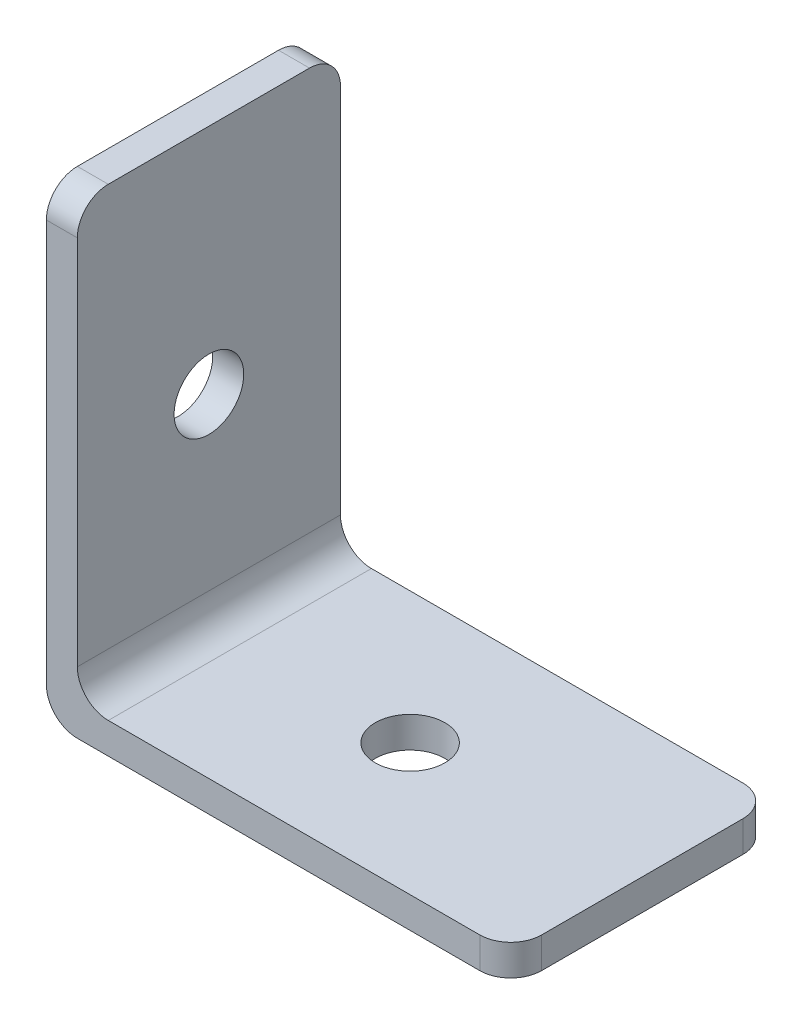
from build123d import *

# Parameters (mm, degrees)
EXTRUDE_THIN1_DEPTH = 17
FILLET1_R           = 2
FILLET2_R           = 2
SKETCH2_R           = 2.25
CUT_EXTRUDE1_DEPTH  = 10
SKETCH4_R           = 2.25
CUT_EXTRUDE2_DEPTH  = 10


with BuildPart() as part:
    # Sketch1 → Extrude-Thin1 (new body)
    with BuildSketch(Plane.XY):
        Polygon((0, 30), (0, 0), (30, 0), (30, 2), (2, 2), (2, 30), align=None)
    extrude(amount=EXTRUDE_THIN1_DEPTH)

    # Fillet1
    fillet1_edges = [part.edges().sort_by_distance(p)[0] for p in [
        (1, 30, 17),
        (1, 30, 0),
        (30, 1, 0),
        (30, 1, 17),
    ]]
    fillet(fillet1_edges, radius=FILLET1_R)

    # Fillet2
    fillet2_edges = [part.edges().sort_by_distance(p)[0] for p in [
        (0, 0, 8.5),
        (2, 2, 8.5),
    ]]
    fillet(fillet2_edges, radius=FILLET2_R)

    # Sketch2 → Cut-Extrude1 (cut)
    with BuildSketch(Plane.ZY):
        with Locations((8.5, 15)):
            Circle(SKETCH2_R)
    extrude(amount=-CUT_EXTRUDE1_DEPTH, mode=Mode.SUBTRACT)

    # Sketch4 → Cut-Extrude2 (cut)
    with BuildSketch(Plane.XZ):
        with Locations(Location((15, 8.5, 0), (0, 0, 270))):
            Circle(SKETCH4_R)
    extrude(amount=-CUT_EXTRUDE2_DEPTH, mode=Mode.SUBTRACT)


solid = part.part
